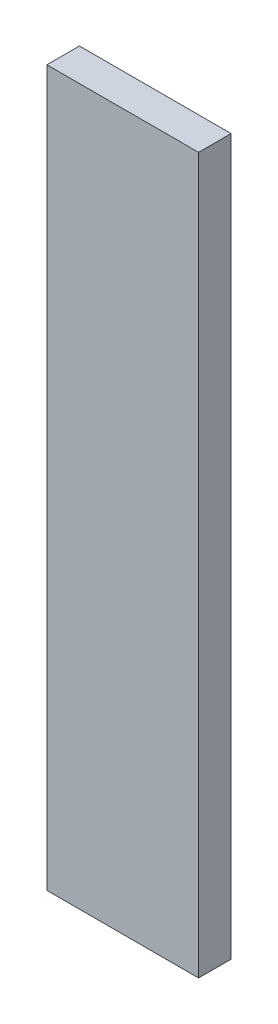
from build123d import *

# Parameters (mm, degrees)
SKETCH1_W           = 88.9
SKETCH1_H           = 19.05
BOSS_EXTRUDE1_DEPTH = 419.1


with BuildPart() as part:
    # Sketch1 → Boss-Extrude1 (new body)
    with BuildSketch(Plane(origin=(0, 0, 0), x_dir=(1, 0, 0), z_dir=(0, 1, 0))):
        with Locations((44.45, 9.525)):
            Rectangle(SKETCH1_W, SKETCH1_H)
    extrude(amount=BOSS_EXTRUDE1_DEPTH)


solid = part.part
